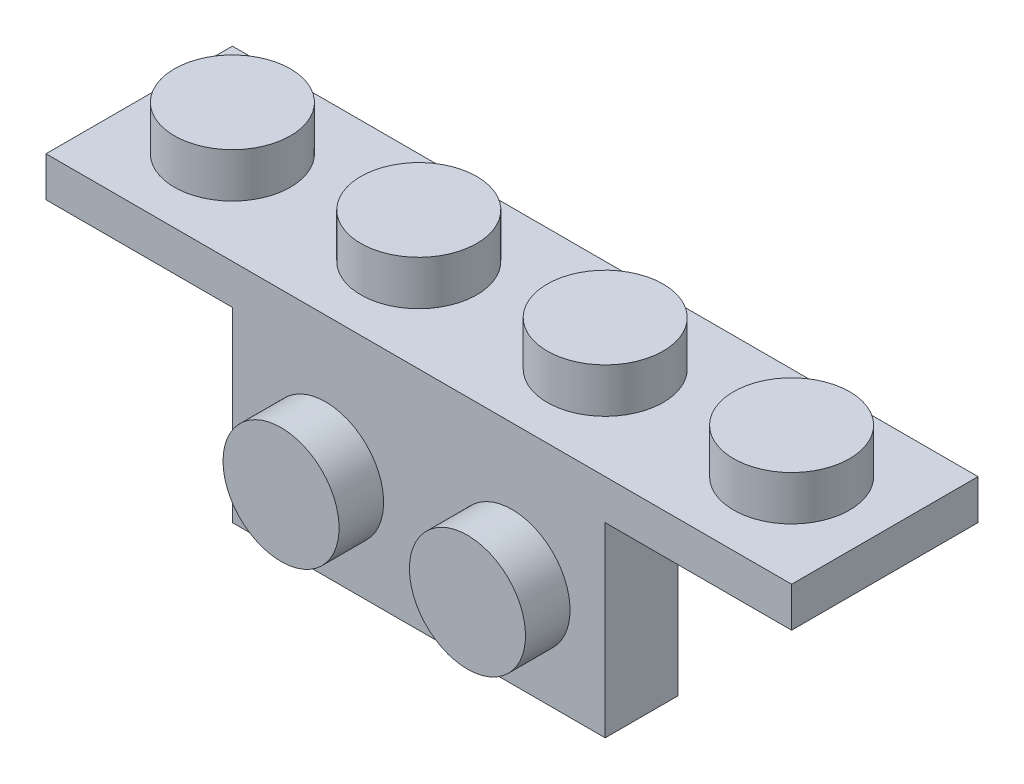
from build123d import *

# Parameters (mm, degrees)
SKETCH1_W           = 15.9
SKETCH1_H           = 7.95
BOSS_EXTRUDE1_DEPTH = 3.1
SKETCH2_R           = 2.475
BOSS_EXTRUDE2_DEPTH = 1.9
SKETCH3_W           = 12.9
SKETCH3_H           = 4.95
CUT_EXTRUDE1_DEPTH  = 2
SKETCH4_W           = 31.8
SKETCH4_H           = 7.95
BOSS_EXTRUDE3_DEPTH = 1.7
SKETCH5_R           = 2.475
BOSS_EXTRUDE4_DEPTH = 1.9
LPATTERN1_COUNT     = 4
LPATTERN1_PITCH     = 7.95


with BuildPart() as part:
    # Sketch1 → Boss-Extrude1 (new body)
    with BuildSketch(Plane.XY):
        with Locations((7.95, -3.975)):
            Rectangle(SKETCH1_W, SKETCH1_H)
    extrude(amount=BOSS_EXTRUDE1_DEPTH)

    # Sketch2 → Boss-Extrude2 (add)
    with BuildSketch(Plane.XY.offset(3.1)):
        with Locations(Location((3.975, -3.975, 0), (0, 0, 180))):
            Circle(SKETCH2_R)
        with Locations(Location((11.925, -3.975, 0), (0, 0, 180))):
            Circle(SKETCH2_R)
    extrude(amount=BOSS_EXTRUDE2_DEPTH)

    # Sketch3 → Cut-Extrude1 (cut)
    with BuildSketch(Plane(origin=(0, 0, 0), x_dir=(-1, 0, 0), z_dir=(0, 0, -1))):
        with Locations((-7.95, -3.975)):
            Rectangle(SKETCH3_W, SKETCH3_H)
    extrude(amount=-CUT_EXTRUDE1_DEPTH, mode=Mode.SUBTRACT)

    # Sketch4 → Boss-Extrude3 (add)
    with BuildSketch(Plane(origin=(0, 0, 0), x_dir=(1, 0, 0), z_dir=(0, 1, 0))):
        with Locations((7.95, 0.875)):
            Rectangle(SKETCH4_W, SKETCH4_H)
    extrude(amount=BOSS_EXTRUDE3_DEPTH)

    # Sketch5 → Boss-Extrude4 (add)
    with BuildSketch(Plane(origin=(0, 1.7, 0), x_dir=(1, 0, 0), z_dir=(0, 1, 0))):
        with Locations(Location((-3.975, 0.875, 0), (0, 0, 90))):
            Circle(SKETCH5_R)
    boss_extrude4 = extrude(amount=BOSS_EXTRUDE4_DEPTH)

    # LPattern1: Boss-Extrude4 ×4
    with Locations(*[(i * LPATTERN1_PITCH, 0, 0) for i in range(1, LPATTERN1_COUNT)]):
        add(boss_extrude4)


solid = part.part
